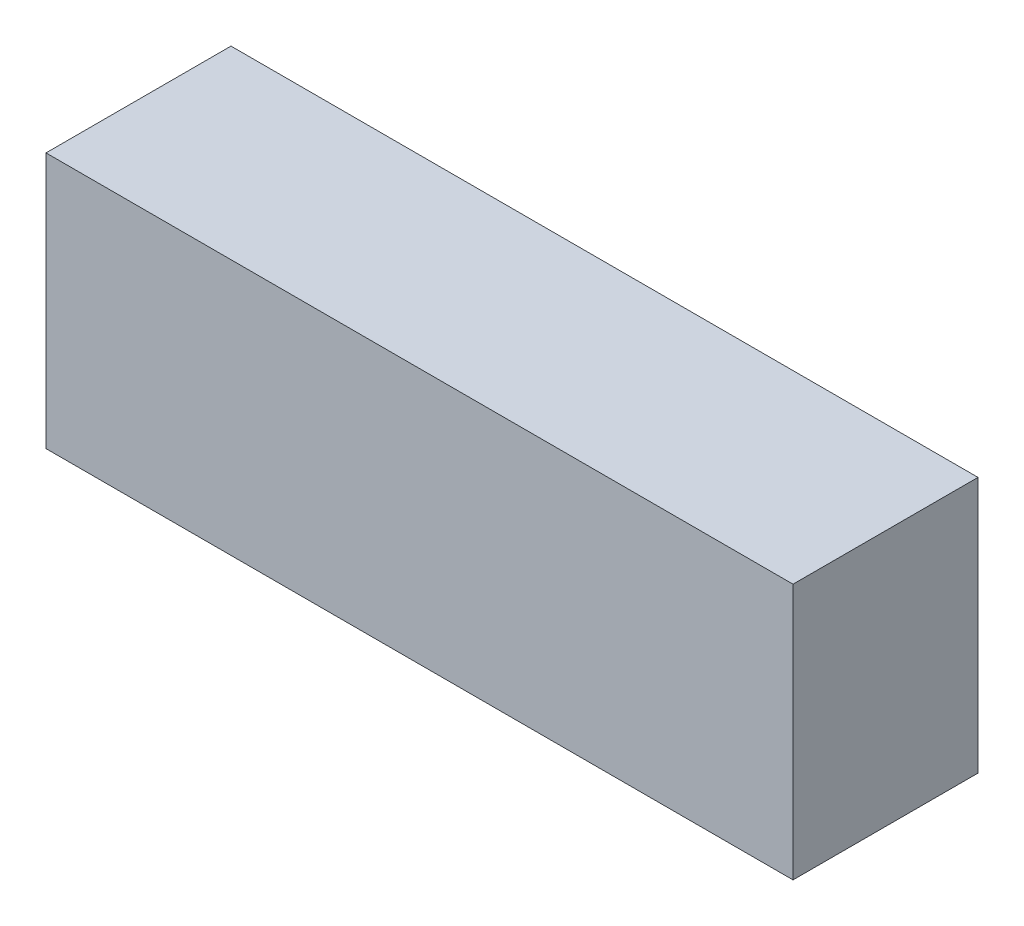
from build123d import *

# Parameters (mm, degrees)
SKETCH1_W           = 105
SKETCH1_H           = 36
BOSS_EXTRUDE1_DEPTH = 26


with BuildPart() as part:
    # Sketch1 → Boss-Extrude1 (new body)
    with BuildSketch(Plane.XY):
        Rectangle(SKETCH1_W, SKETCH1_H)
    extrude(amount=BOSS_EXTRUDE1_DEPTH)


solid = part.part
